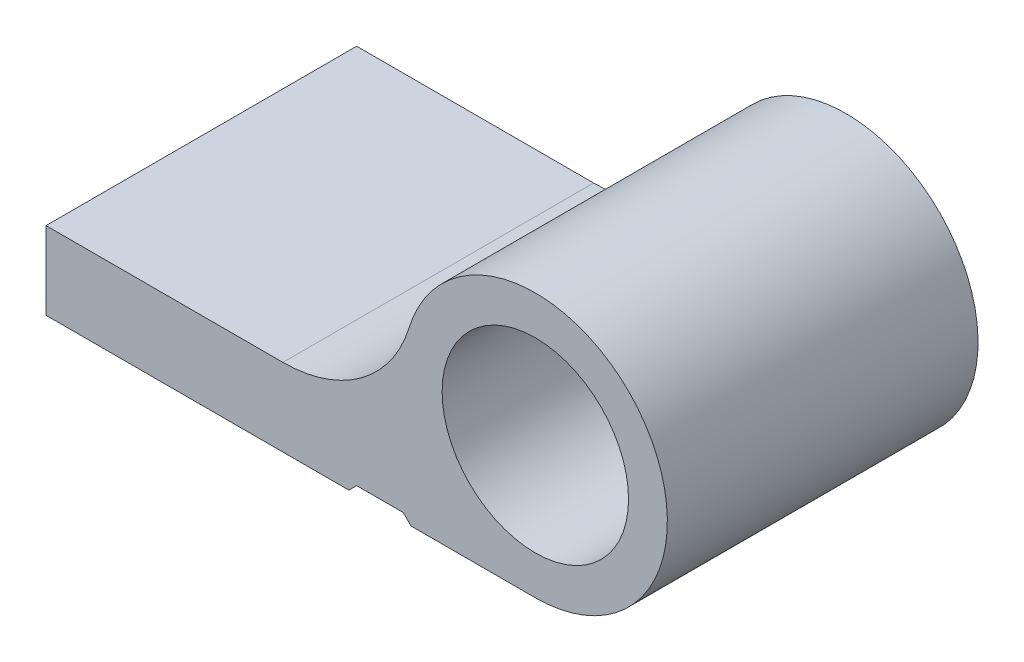
from build123d import *

# Parameters (mm, degrees)
SKETCH_2_R          = 6
EXTRUDE_1_DEPTH     = 20
FILLET_1_R          = 8.5
SKETCH_3_W          = 3
SKETCH_3_H          = 0.5
CUT_EXTRUDE_1_DEPTH = 100
CUT_EXTRUDE_2_DEPTH = 100


with BuildPart() as part:
    # 草图2 → 凸台-拉伸1 (new body)
    with BuildSketch(Plane.XY):
        with BuildLine():
            ThreePointArc((23, 8.5), (37.51040764, 14.51040764), (31.5, 0))
            Line((31.5, 0), (23, 0))
            Line((23, 0), (20, 0))
            Line((20, 0), (0, 0))
            Line((0, 0), (0, 5))
            Line((0, 5), (23, 5))
            Line((23, 5), (23, 8.5))
        make_face()
        with Locations((31.5, 8.5)):
            Circle(SKETCH_2_R, mode=Mode.SUBTRACT)
    extrude(amount=EXTRUDE_1_DEPTH)

    # 圆角1
    fillet_1_edges = [part.edges().sort_by_distance(p)[0] for p in [
        (23, 5, 10),
    ]]
    fillet(fillet_1_edges, radius=FILLET_1_R)

    # 草图3 → 切除-拉伸1 (cut)
    with BuildSketch(Plane.XY.offset(20)):
        with Locations((21.5, 0.25)):
            Rectangle(SKETCH_3_W, SKETCH_3_H)
    extrude(amount=-CUT_EXTRUDE_1_DEPTH, mode=Mode.SUBTRACT)

    # 草图4 → 切除-拉伸2 (cut)
    with BuildSketch(Plane.XY.offset(20)):
        Polygon((23, 0), (23.5, 0), (23, 0.5), align=None)
        Polygon((20, 0), (19.5, 0), (20, 0.5), align=None)
    extrude(amount=-CUT_EXTRUDE_2_DEPTH, mode=Mode.SUBTRACT)


solid = part.part
